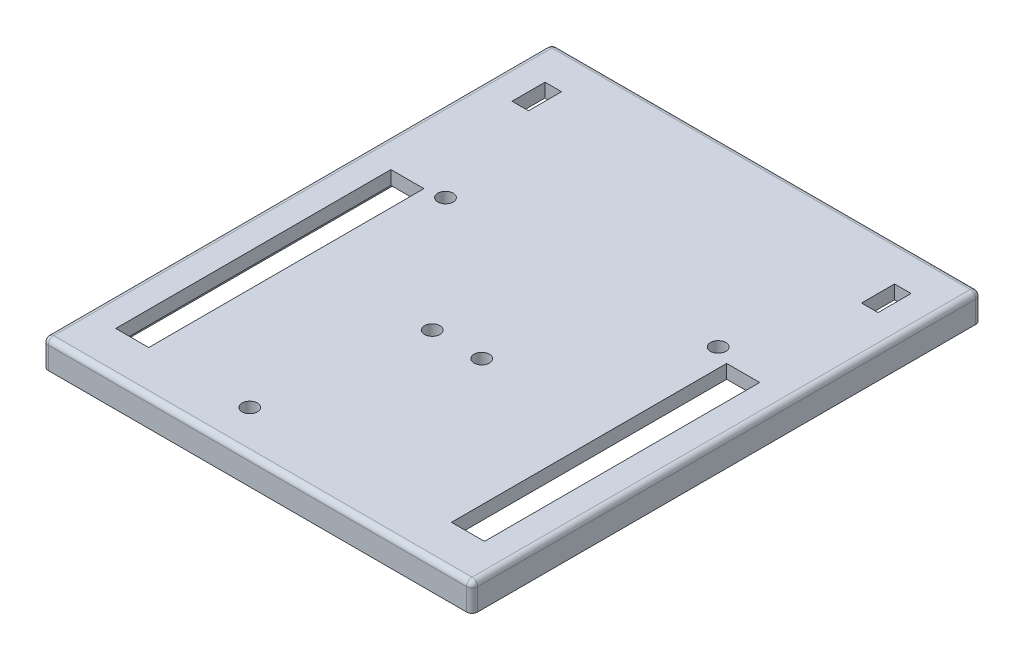
from build123d import *

# Parameters (mm, degrees)
SKETCH1_W                         = 78
SKETCH1_H                         = 92.5
SKETCH1_R                         = 1.4
SKETCH1_W_2                       = 6
SKETCH1_H_2                       = 50
SKETCH1_W_3                       = 3
SKETCH1_H_3                       = 6
BASE_DEPTH                        = 5
SKETCH2_W                         = 71.5
SKETCH2_H                         = 84
PCB_CUTOUT_DEPTH                  = 2.5
F_1MM_EDGE_FILLETS_R              = 1
BASKET_CLAMP_MOUNTING_HOLES_REACH = 62.705
SKETCH3_R                         = 1.4


with BuildPart() as part:
    # Sketch1 → Base (new body)
    with BuildSketch(Plane(origin=(0, 0, 0), x_dir=(1, 0, 0), z_dir=(0, 1, 0))):
        Rectangle(SKETCH1_W, SKETCH1_H)
        with Locations((-24.13, 12.05)):
            Circle(SKETCH1_R, mode=Mode.SUBTRACT)
        with Locations((24.13, 13.32)):
            Circle(SKETCH1_R, mode=Mode.SUBTRACT)
        with Locations((-8.89, -38.75)):
            Circle(SKETCH1_R, mode=Mode.SUBTRACT)
        with Locations((-30.5, -13.5)):
            Rectangle(SKETCH1_W_2, SKETCH1_H_2, mode=Mode.SUBTRACT)
        with Locations((30.5, -13.5)):
            Rectangle(SKETCH1_W_2, SKETCH1_H_2, mode=Mode.SUBTRACT)
        with Locations((31.75, 36.25)):
            Rectangle(SKETCH1_W_3, SKETCH1_H_3, mode=Mode.SUBTRACT)
        with Locations((-31.75, 36.25)):
            Rectangle(SKETCH1_W_3, SKETCH1_H_3, mode=Mode.SUBTRACT)
    extrude(amount=BASE_DEPTH)

    # Sketch2 → PCB Cutout (cut)
    with BuildSketch(Plane(origin=(0, 0, 0), x_dir=(1, 0, 0), z_dir=(0, 1, 0))):
        Rectangle(SKETCH2_W, SKETCH2_H)
    extrude(amount=PCB_CUTOUT_DEPTH, mode=Mode.SUBTRACT)

    # 1mm Edge Fillets
    f_1mm_edge_fillets_edges = [part.edges().sort_by_distance(p)[0] for p in [
        (-39, 2.5, -46.25),
        (0, 5, -46.25),
        (39, 2.5, -46.25),
        (39, 5, 0),
        (39, 2.5, 46.25),
        (0, 5, 46.25),
        (-39, 5, 0),
        (-39, 2.5, 46.25),
    ]]
    fillet(f_1mm_edge_fillets_edges, radius=F_1MM_EDGE_FILLETS_R)

    # Sketch3 → Basket Clamp Mounting Holes (cut, up to next)
    with BuildSketch(Plane(origin=(0, 5, 0), x_dir=(1, 0, 0), z_dir=(0, 1, 0)), mode=Mode.PRIVATE) as basket_clamp_mounting_holes_sk1:
        with Locations((-4.5, -10)):
            Circle(SKETCH3_R)
    basket_clamp_mounting_holes_tool1 = extrude(basket_clamp_mounting_holes_sk1.sketch, amount=-BASKET_CLAMP_MOUNTING_HOLES_REACH, mode=Mode.PRIVATE) & part.part
    # Sketch3 → Basket Clamp Mounting Holes (cut, up to next)
    with BuildSketch(Plane(origin=(0, 5, 0), x_dir=(1, 0, 0), z_dir=(0, 1, 0)), mode=Mode.PRIVATE) as basket_clamp_mounting_holes_sk2:
        with Locations((4.5, -10)):
            Circle(SKETCH3_R)
    basket_clamp_mounting_holes_tool2 = extrude(basket_clamp_mounting_holes_sk2.sketch, amount=-BASKET_CLAMP_MOUNTING_HOLES_REACH, mode=Mode.PRIVATE) & part.part
    add(basket_clamp_mounting_holes_tool1.solids().sort_by_distance((-4.5, 5, 10))[0], mode=Mode.SUBTRACT)
    add(basket_clamp_mounting_holes_tool2.solids().sort_by_distance((4.5, 5, 10))[0], mode=Mode.SUBTRACT)


solid = part.part
